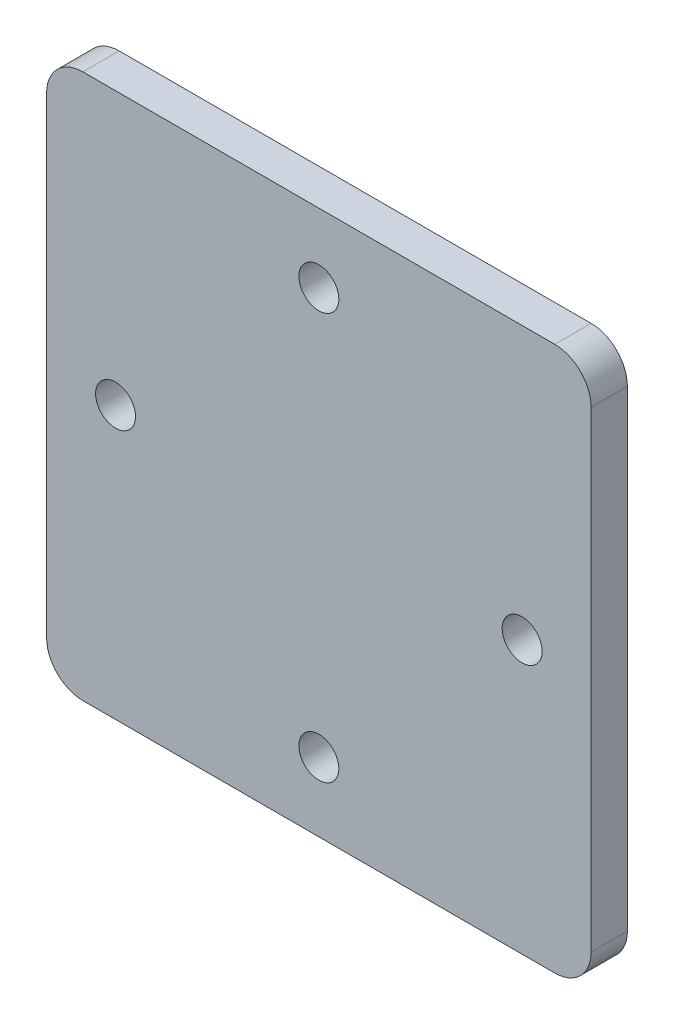
from build123d import *

# Parameters (mm, degrees)
ESTRUSIONE1_DEPTH  = 10
M10_GIOCHI_FORO1_D = 11


with BuildPart() as part:
    # Schizzo1 → Estrusione1 (new body)
    with BuildSketch(Plane.XY):
        with BuildLine():
            Line((65, -75), (-65, -75))
            ThreePointArc((-65, -75), (-72.071067812, -72.071067812), (-75, -65))
            Line((-75, -65), (-75, 65))
            ThreePointArc((-75, 65), (-72.071067812, 72.071067812), (-65, 75))
            Line((-65, 75), (65, 75))
            ThreePointArc((65, 75), (72.071067812, 72.071067812), (75, 65))
            Line((75, 65), (75, -65))
            ThreePointArc((75, -65), (72.071067812, -72.071067812), (65, -75))
        make_face()
    extrude(amount=ESTRUSIONE1_DEPTH)

    # M10 Giochi foro1 (through all)
    with Locations(Plane(origin=(-8.776304657, -26.12912926, 0), x_dir=(-0.9999999999861038, 5.271864407281465e-06, 0), z_dir=(0, 0, -1))):
        with Locations((-8.776166907, 82.129175527), (-8.776166907, -29.870824473), (-64.776166907, 26.129175527), (47.223833093, 26.129175527)):
            Hole(M10_GIOCHI_FORO1_D / 2)


solid = part.part
